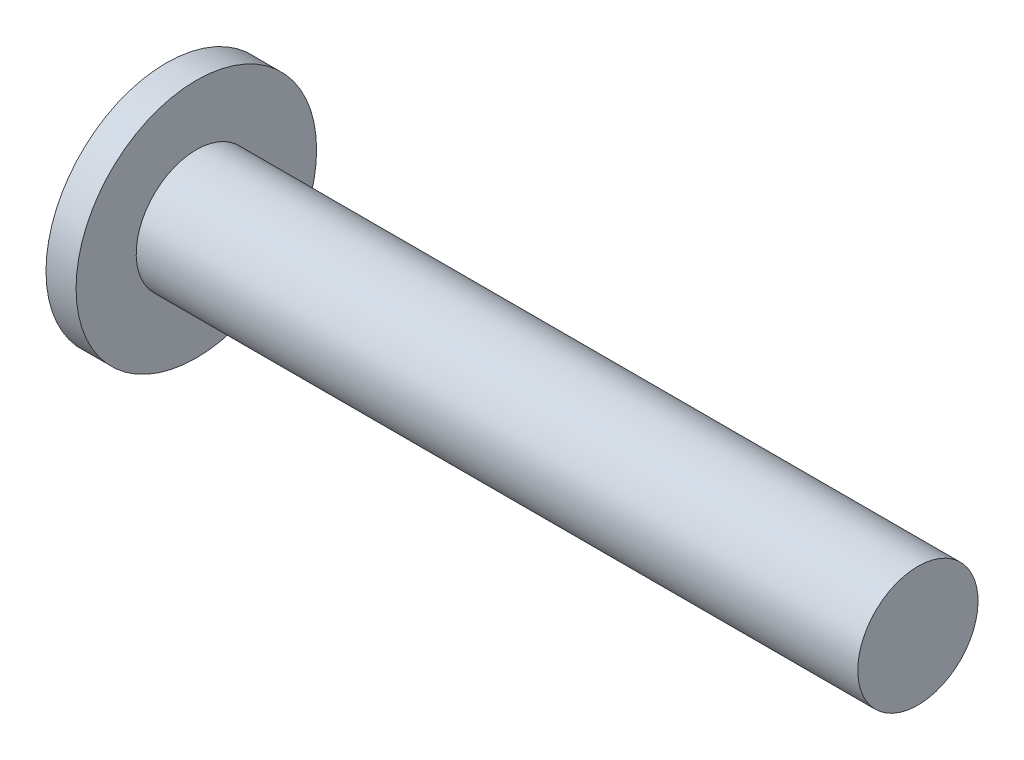
from build123d import *

# Parameters (mm, degrees)
SCALE1_SCALE = 0.35


with BuildPart() as part:
    # Sketch4 → Revolve1 (revolve)
    with BuildSketch(Plane.XY):
        Polygon((0, 0), (0, 40), (10, 40), (10, 20), (250, 20), (250, 0), align=None)
    revolve(axis=Axis((250, 0, 0), (-1, 0, 0)))


with BuildPart() as part_1:
    # Scale1: scaled about (112.142857143, 0, 0)
    add(part.part.scale(SCALE1_SCALE).moved(Location((72.892857143, 0, 0))))


solid = part_1.part
